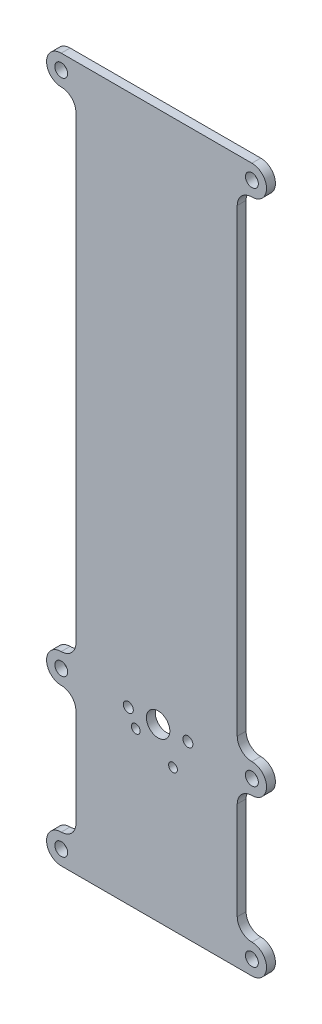
from build123d import *

# Parameters (mm, degrees)
SKETCH1_R           = 0.85
SKETCH1_R_2         = 2
SKETCH1_R_3         = 0.75
SKETCH1_R_4         = 1.1
BOSS_EXTRUDE1_DEPTH = 1.51


with BuildPart() as part:
    # Sketch1 → Boss-Extrude1 (new body)
    with BuildSketch(Plane.XY):
        with BuildLine():
            Line((136.512, -46.6938), (104.012, -46.6938))
            ThreePointArc((104.012, -46.6938), (101.512, -49.1938), (104.012, -51.6938))
            ThreePointArc((104.012, -51.6938), (105.779767, -52.426033), (106.512, -54.1938))
            Line((106.512, -54.1938), (106.512, -132.541))
            ThreePointArc((106.512, -132.541), (105.779767, -134.308767), (104.012, -135.041))
            ThreePointArc((104.012, -135.041), (101.512, -137.541), (104.012, -140.041))
            ThreePointArc((104.012, -140.041), (105.779767, -140.773233), (106.512, -142.541))
            Line((106.512, -142.541), (106.512, -159.1938))
            ThreePointArc((106.512, -159.1938), (105.779767, -160.961567), (104.012, -161.6938))
            ThreePointArc((104.012, -161.6938), (101.512, -164.1938), (104.012, -166.6938))
            Line((104.012, -166.6938), (136.512, -166.6938))
            ThreePointArc((136.512, -166.6938), (139.012, -164.1938), (136.512, -161.6938))
            ThreePointArc((136.512, -161.6938), (134.744233, -160.961567), (134.012, -159.1938))
            Line((134.012, -159.1938), (134.012, -142.541))
            ThreePointArc((134.012, -142.541), (134.744233, -140.773233), (136.512, -140.041))
            ThreePointArc((136.512, -140.041), (139.012, -137.541), (136.512, -135.041))
            ThreePointArc((136.512, -135.041), (134.744233, -134.308767), (134.012, -132.541))
            Line((134.012, -132.541), (134.012, -54.1938))
            ThreePointArc((134.012, -54.1938), (134.744233, -52.426033), (136.512, -51.6938))
            ThreePointArc((136.512, -51.6938), (139.012, -49.1938), (136.512, -46.6938))
        make_face()
        with Locations((125.603, -137.541)):
            Circle(SKETCH1_R, mode=Mode.SUBTRACT)
        with Locations((120.523, -137.541)):
            Circle(SKETCH1_R_2, mode=Mode.SUBTRACT)
        with Locations((115.443, -137.541)):
            Circle(SKETCH1_R, mode=Mode.SUBTRACT)
        with Locations((116.713, -140.081)):
            Circle(SKETCH1_R_3, mode=Mode.SUBTRACT)
        with Locations((123.063, -142.621)):
            Circle(SKETCH1_R_3, mode=Mode.SUBTRACT)
        with Locations((104.012, -137.541)):
            Circle(SKETCH1_R_4, mode=Mode.SUBTRACT)
        with Locations((104.012, -164.1938)):
            Circle(SKETCH1_R_4, mode=Mode.SUBTRACT)
        with Locations((136.512, -164.1938)):
            Circle(SKETCH1_R_4, mode=Mode.SUBTRACT)
        with Locations((136.512, -137.541)):
            Circle(SKETCH1_R_4, mode=Mode.SUBTRACT)
        with Locations((136.512, -49.1938)):
            Circle(SKETCH1_R_4, mode=Mode.SUBTRACT)
        with Locations((104.012, -49.1938)):
            Circle(SKETCH1_R_4, mode=Mode.SUBTRACT)
    extrude(amount=-BOSS_EXTRUDE1_DEPTH)


solid = part.part
